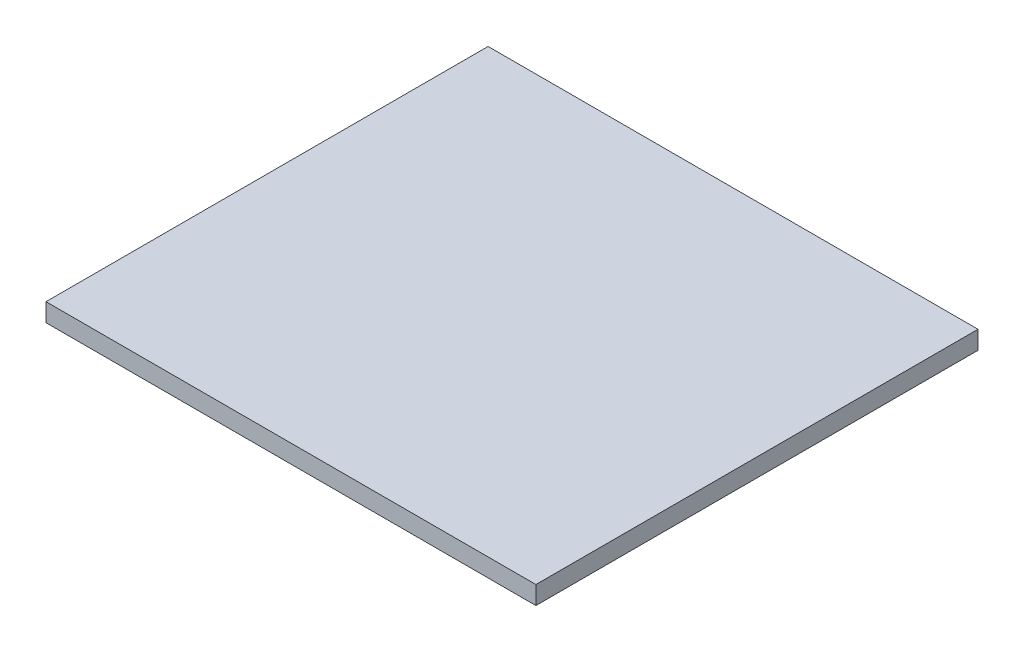
from build123d import *

# Parameters (mm, degrees)
SKETCH1_W           = 82
SKETCH1_H           = 74
BOSS_EXTRUDE1_DEPTH = 3.05


with BuildPart() as part:
    # Sketch1 → Boss-Extrude1 (new body)
    with BuildSketch(Plane(origin=(0, 0, 0), x_dir=(1, 0, 0), z_dir=(0, 1, 0))):
        with Locations((50, 37)):
            Rectangle(SKETCH1_W, SKETCH1_H)
    extrude(amount=BOSS_EXTRUDE1_DEPTH)


solid = part.part
